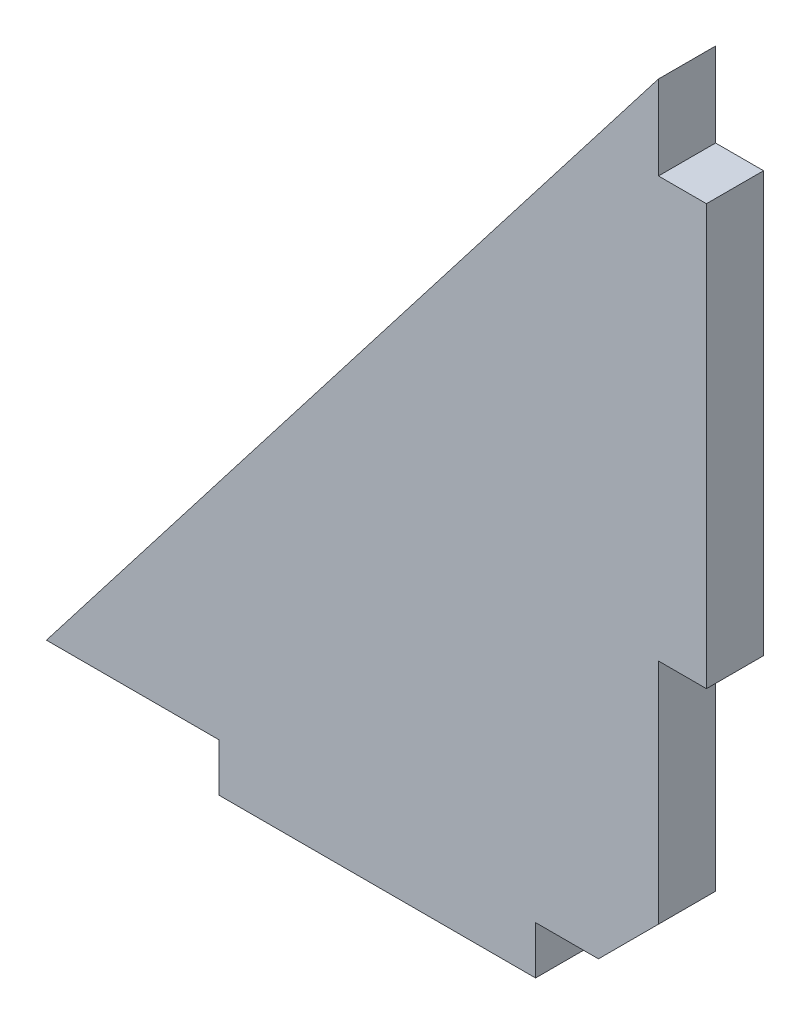
from build123d import *

# Parameters (mm, degrees)
RESSALTO_EXTRUS_O1_DEPTH = 4.76


with BuildPart() as part:
    # Esboço1 → Ressalto-extrusão1 (new body)
    with BuildSketch(Plane.XY):
        Polygon((0, 0), (0, -7), (4, -7), (4, -42), (0, -42), (0, -61), (-5, -66), (-10.24, -66), (-10.24, -70), (-36.64, -70), (-36.64, -66), (-51, -66), align=None)
    extrude(amount=RESSALTO_EXTRUS_O1_DEPTH)


solid = part.part
